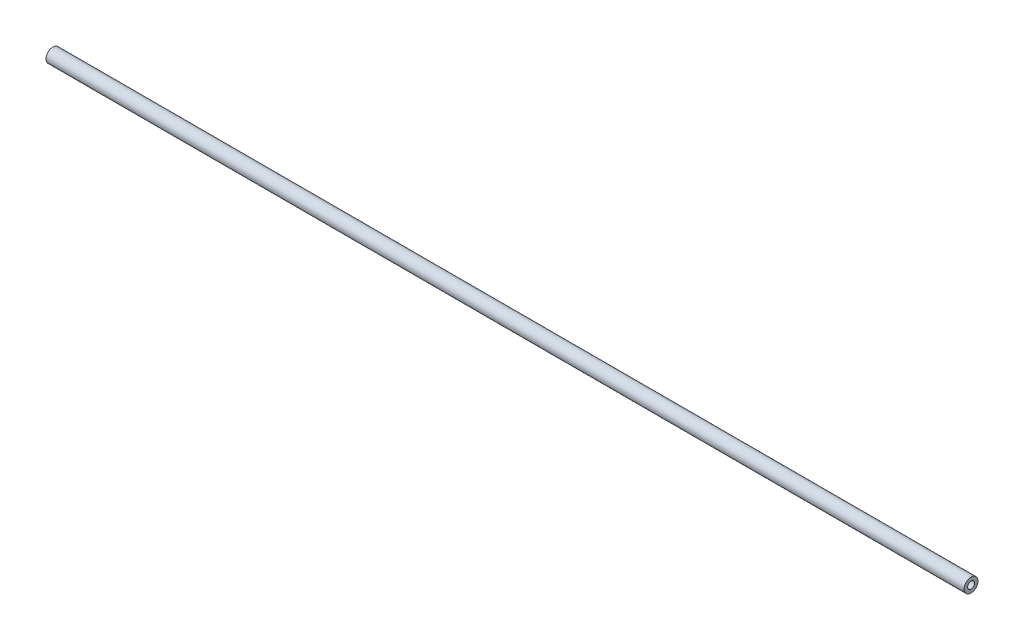
from build123d import *

# Parameters (mm, degrees)
SKETCH2_R           = 6.35
SKETCH2_R_2         = 3.175
BOSS_EXTRUDE2_DEPTH = 841.1765625


with BuildPart() as part:
    # Sketch2 → Boss-Extrude2 (new body)
    with BuildSketch(Plane(origin=(0, 0, 0), x_dir=(0, 0, -1), z_dir=(1, 0, 0))):
        Circle(SKETCH2_R)
        Circle(SKETCH2_R_2, mode=Mode.SUBTRACT)
    extrude(amount=BOSS_EXTRUDE2_DEPTH)


solid = part.part
